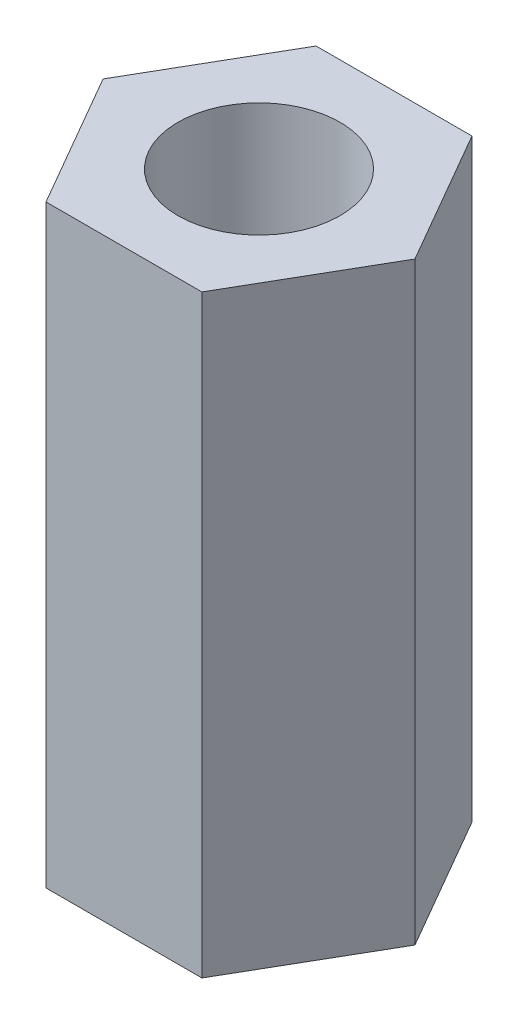
from build123d import *

# Parameters (mm, degrees)
CROQUIS1_R              = 1.5
SALIENTE_EXTRUIR1_DEPTH = 6
CUT_EXTRUDE_1_DEPTH     = 1


with BuildPart() as part:
    # Croquis1 → Saliente-Extruir1 (new, symmetric)
    with BuildSketch(Plane(origin=(0, 0, 0), x_dir=(1, 0, 0), z_dir=(0, 1, 0))):
        Polygon((1.443375673, -2.5), (2.886751346, 0), (1.443375673, 2.5), (-1.443375673, 2.5), (-2.886751346, 0), (-1.443375673, -2.5), align=None)
        with Locations(Location((0, 0, 0), (0, 0, 270))):
            Circle(CROQUIS1_R, mode=Mode.SUBTRACT)
    extrude(amount=SALIENTE_EXTRUIR1_DEPTH, both=True)

    # 草图1 → 切除-拉伸1 (cut)
    with BuildSketch(Plane(origin=(0, 6, 0), x_dir=(1, 0, 0), z_dir=(0, 1, 0))):
        Polygon((-1.443375673, -2.5), (1.443375673, -2.5), (2.886751346, 0), (1.443375673, 2.5), (-1.443375673, 2.5), (-2.886751346, 0), align=None)
    extrude(amount=-CUT_EXTRUDE_1_DEPTH, mode=Mode.SUBTRACT)


solid = part.part
